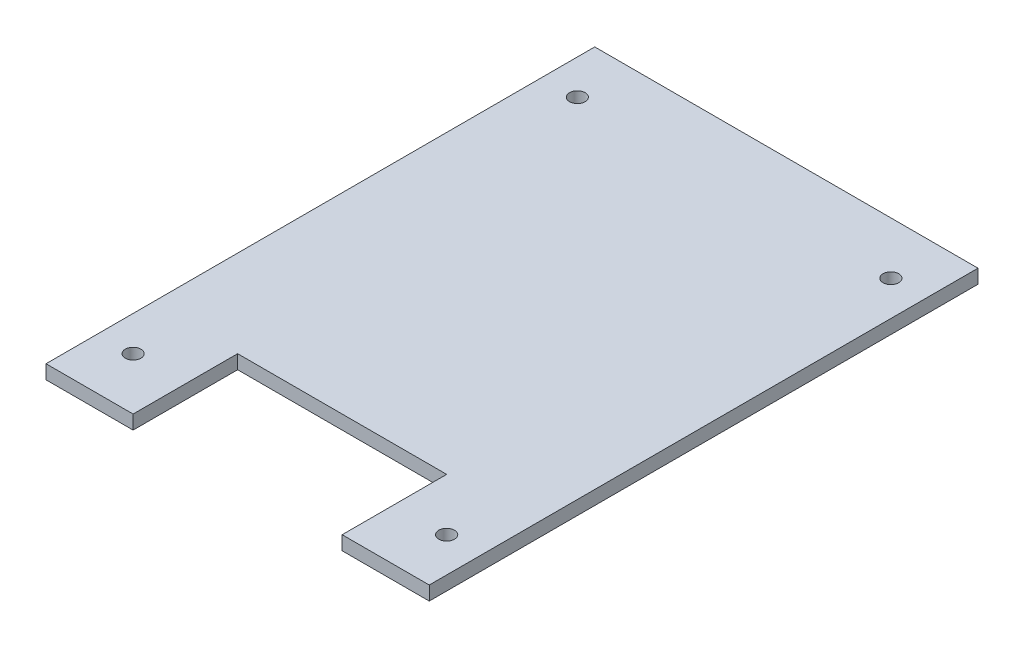
from build123d import *

# Parameters (mm, degrees)
RESSALTO_EXTRUS_O1_DEPTH = 4
FURO_COM_FOLGA_DE_M41_D  = 4.5


with BuildPart() as part:
    # Esboço1 → Ressalto-extrusão1 (new body)
    with BuildSketch(Plane(origin=(0, 0, 0), x_dir=(1, 0, 0), z_dir=(0, 1, 0))):
        Polygon((30, -78.75), (55, -78.75), (55, 78.75), (-55, 78.75), (-55, -78.75), (-30, -78.75), (-30, -48.75), (30, -48.75), align=None)
    extrude(amount=RESSALTO_EXTRUS_O1_DEPTH)

    # Furo com folga de M41 (through all)
    with Locations(Plane(origin=(0, 4, 0), x_dir=(1, 0, 0), z_dir=(0, 1, 0))):
        with Locations((-45, 63.75), (45, 63.75), (45, -63.75), (-45, -63.75)):
            Hole(FURO_COM_FOLGA_DE_M41_D / 2)


solid = part.part
